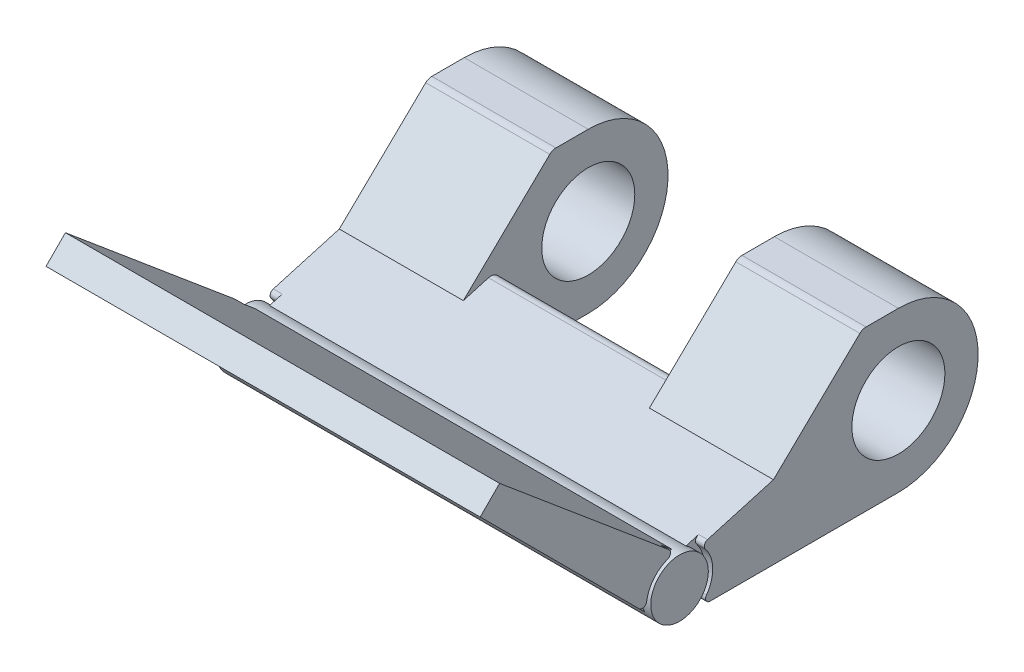
from build123d import *
from build123d.topology import SkipClean

# Parameters (mm, degrees)
SKETCH2_R               = 5.25
BOSS_EXTRUDE1_DEPTH     = 14
CUT_EXTRUDE1_DEPTH      = 1
CUT_EXTRUDE2_DEPTH      = 1
BOSS_EXTRUDE2_DEPTH     = 9
BOSS_EXTRUDE3_DEPTH     = 9.5
FILLET1_R               = 1
FILLET1_OF_MIRROR1_R    = 1
CUT_EXTRUDE3_DEPTH      = 57.347139
CUT_EXTRUDE3_DEPTH_BACK = 57.347139
BOSS_EXTRUDE4_DEPTH     = 1.5


with BuildPart() as part:
    # Sketch2 → Boss-Extrude1 (new body)
    with BuildSketch(Plane(origin=(0, 0, 0), x_dir=(0, 0, -1), z_dir=(1, 0, 0))):
        with BuildLine():
            ThreePointArc((0, 0), (9, 9), (0, 18))
            Line((0, 18), (-4.055356, 18))
            Line((-4.055356, 18), (-14.1, 8.3))
            Line((-14.1, 8.3), (-22.975774, 5.754913))
            ThreePointArc((-22.975774, 5.754913), (-23.743648, 6.106105), (-24.576075, 6.247636))
            Line((-24.576075, 6.247636), (-45.007969, 23.392031))
            Line((-45.007969, 23.392031), (-47.2, 21.2))
            Line((-47.2, 21.2), (-27.661634, 1.661634))
            ThreePointArc((-27.661634, 1.661634), (-25.892761, -0.023214), (-23.45, 0))
            Line((-23.45, 0), (0, 0))
        make_face()
        with Locations((0, 9)):
            Circle(SKETCH2_R, mode=Mode.SUBTRACT)
    boss_extrude1 = extrude(amount=-BOSS_EXTRUDE1_DEPTH)

    # Sketch2<5> → Cut-Extrude1 (cut)
    with BuildSketch(Plane(origin=(0, 0, 0), x_dir=(0, 0, -1), z_dir=(1, 0, 0))):
        with BuildLine():
            Line((-29.259155, 3.259155), (-27.661634, 1.661634))
            ThreePointArc((-27.661634, 1.661634), (-27.39648, 4.814248), (-24.576075, 6.247636))
            Line((-24.576075, 6.247636), (-25.894138, 7.353622))
            ThreePointArc((-25.894138, 7.353622), (-25.722467, 6.887608), (-26.037234, 6.503471))
            ThreePointArc((-26.037234, 6.503471), (-27.62666, 5.344603), (-28.410825, 3.540625))
            ThreePointArc((-28.410825, 3.540625), (-28.748146, 3.138148), (-29.259155, 3.259155))
        make_face()
    cut_extrude1 = extrude(amount=-CUT_EXTRUDE1_DEPTH, mode=Mode.SUBTRACT)

    # Sketch2<6> → Cut-Extrude2 (cut)
    with SkipClean():  # the faces are left unmerged after this step: merging them gives an invalid solid
        with BuildSketch(Plane(origin=(0, 0, 0), x_dir=(0, 0, -1), z_dir=(1, 0, 0))):
            with BuildLine():
                Line((-23.45, 0), (-21.263068, 0))
                ThreePointArc((-21.263068, 0), (-21.708635, 0.273129), (-21.667413, 0.794118))
                ThreePointArc((-21.667413, 0.794118), (-20.951416, 3.103029), (-21.793156, 5.369126))
                ThreePointArc((-21.793156, 5.369126), (-21.882672, 5.834611), (-21.543396, 6.165641))
                Line((-21.543396, 6.165641), (-22.975774, 5.754913))
                ThreePointArc((-22.975774, 5.754913), (-21.856918, 4.574606), (-21.45, 3))
                ThreePointArc((-21.45, 3), (-21.995837, 1.197224), (-23.45, 0))
            make_face()
        cut_extrude2 = extrude(amount=-CUT_EXTRUDE2_DEPTH, mode=Mode.SUBTRACT)

    # Sketch3 → Boss-Extrude2 (add)
    with SkipClean():  # the faces are left unmerged after this step: merging them gives an invalid solid
        with BuildSketch(Plane.ZY.offset(14)):
            with BuildLine():
                Line((47.2, 21.2), (45.007969, 23.392031))
                Line((45.007969, 23.392031), (24.576075, 6.247636))
                ThreePointArc((24.576075, 6.247636), (23.743648, 6.106105), (22.975774, 5.754913))
                Line((22.975774, 5.754913), (11.25959, 9.114474))
                ThreePointArc((11.25959, 9.114474), (10.413299, 8.974404), (9.986911, 8.230078))
                ThreePointArc((9.986911, 8.230078), (9.041707, 4.689697), (6.886416, 1.72618))
                ThreePointArc((6.886416, 1.72618), (6.644894, 0.629987), (7.57392, 0))
                Line((7.57392, 0), (23.45, 0))
                ThreePointArc((23.45, 0), (25.892761, -0.023214), (27.661634, 1.661634))
                Line((27.661634, 1.661634), (47.2, 21.2))
            make_face()
        boss_extrude2 = extrude(amount=BOSS_EXTRUDE2_DEPTH)

    # Sketch3<3> → Boss-Extrude3 (add)
    with SkipClean():  # the faces are left unmerged after this step: merging them gives an invalid solid
        with BuildSketch(Plane.ZY.offset(14)):
            with BuildLine():
                ThreePointArc((27.95, 3), (26.953857, 5.341501), (24.576075, 6.247636))
                ThreePointArc((24.576075, 6.247636), (23.743648, 6.106105), (22.975774, 5.754913))
                ThreePointArc((22.975774, 5.754913), (21.460978, 2.733093), (23.45, 0))
                ThreePointArc((23.45, 0), (25.892761, -0.023214), (27.661634, 1.661634))
                ThreePointArc((27.661634, 1.661634), (27.877091, 2.31546), (27.95, 3))
            make_face()
        boss_extrude3 = extrude(amount=BOSS_EXTRUDE3_DEPTH)

    # Fillet1
    fillet1_edges = [part.edges().sort_by_distance(p)[0] for p in [
        (-7, 18, 4.055356),
    ]]
    fillet(fillet1_edges, radius=FILLET1_R)

    # Mirror1: Boss-Extrude1, Cut-Extrude1, Cut-Extrude2, Boss-Extrude2, Boss-Extrude3 across plane
    with SkipClean():  # the faces are left unmerged after this step: merging them gives an invalid solid
        add(boss_extrude1.mirror(Plane(origin=(0, 0, 0), x_dir=(0, 0, 1), z_dir=(1, 0, 0))))
        add(cut_extrude1.mirror(Plane(origin=(0, 0, 0), x_dir=(0, 0, 1), z_dir=(1, 0, 0))), mode=Mode.SUBTRACT)
        add(cut_extrude2.mirror(Plane(origin=(0, 0, 0), x_dir=(0, 0, 1), z_dir=(1, 0, 0))), mode=Mode.SUBTRACT)
        add(boss_extrude2.mirror(Plane(origin=(0, 0, 0), x_dir=(0, 0, 1), z_dir=(1, 0, 0))))
        add(boss_extrude3.mirror(Plane(origin=(0, 0, 0), x_dir=(0, 0, 1), z_dir=(1, 0, 0))))

    # Fillet1 of Mirror1
    fillet1_of_mirror1_edges = [part.edges().sort_by_distance(p)[0] for p in [
        (7, 18, 4.055356),
    ]]
    fillet(fillet1_of_mirror1_edges, radius=FILLET1_OF_MIRROR1_R)

    # Sketch4 → Cut-Extrude3 (cut, two sides: drawn at the far end of the back side and taken through both)
    with SkipClean():  # the faces are left unmerged after this step: merging them gives an invalid solid
        with BuildSketch(Plane(origin=(0, -8.435091, 7.077882), x_dir=(1, 0, 0), z_dir=(0, 0.7660444431189767, -0.6427876096865409)).offset(-CUT_EXTRUDE3_DEPTH_BACK)):
            Polygon((0, 0), (0, -53.228637), (-37.923085, -53.228637), (-37.923085, 7.135531), (0, 7.135531), align=None)
        extrude(amount=CUT_EXTRUDE3_DEPTH + CUT_EXTRUDE3_DEPTH_BACK, mode=Mode.SUBTRACT)

    # Sketch7 → Boss-Extrude4 (add)
    with SkipClean():  # the faces are left unmerged after this step: merging them gives an invalid solid
        with BuildSketch(Plane(origin=(23, 0, 0), x_dir=(0, 0, -1), z_dir=(1, 0, 0))):
            with BuildLine():
                Line((-11.25959, 9.114474), (-22.975774, 5.754913))
                ThreePointArc((-22.975774, 5.754913), (-23.743648, 6.106105), (-24.576075, 6.247636))
                Line((-24.576075, 6.247636), (-45.007969, 23.392031))
                Line((-45.007969, 23.392031), (-47.2, 21.2))
                Line((-47.2, 21.2), (-27.661634, 1.661634))
                ThreePointArc((-27.661634, 1.661634), (-25.892761, -0.023214), (-23.45, 0))
                Line((-23.45, 0), (-7.57392, 0))
                ThreePointArc((-7.57392, 0), (-6.644894, 0.629987), (-6.886416, 1.72618))
                ThreePointArc((-6.886416, 1.72618), (-9.041707, 4.689697), (-9.986911, 8.230078))
                ThreePointArc((-9.986911, 8.230078), (-10.413299, 8.974404), (-11.25959, 9.114474))
            make_face()
        extrude(amount=BOSS_EXTRUDE4_DEPTH)

    # Mirror14: part across plane


with BuildPart() as part_1:
    with SkipClean():  # the faces are left unmerged after this step: merging them gives an invalid solid
        add(part.part)
        add(part.part.mirror(Plane(origin=(24.5, 0, 0), x_dir=(0, 0, 1), z_dir=(1, 0, 0))))


solid = part_1.part
